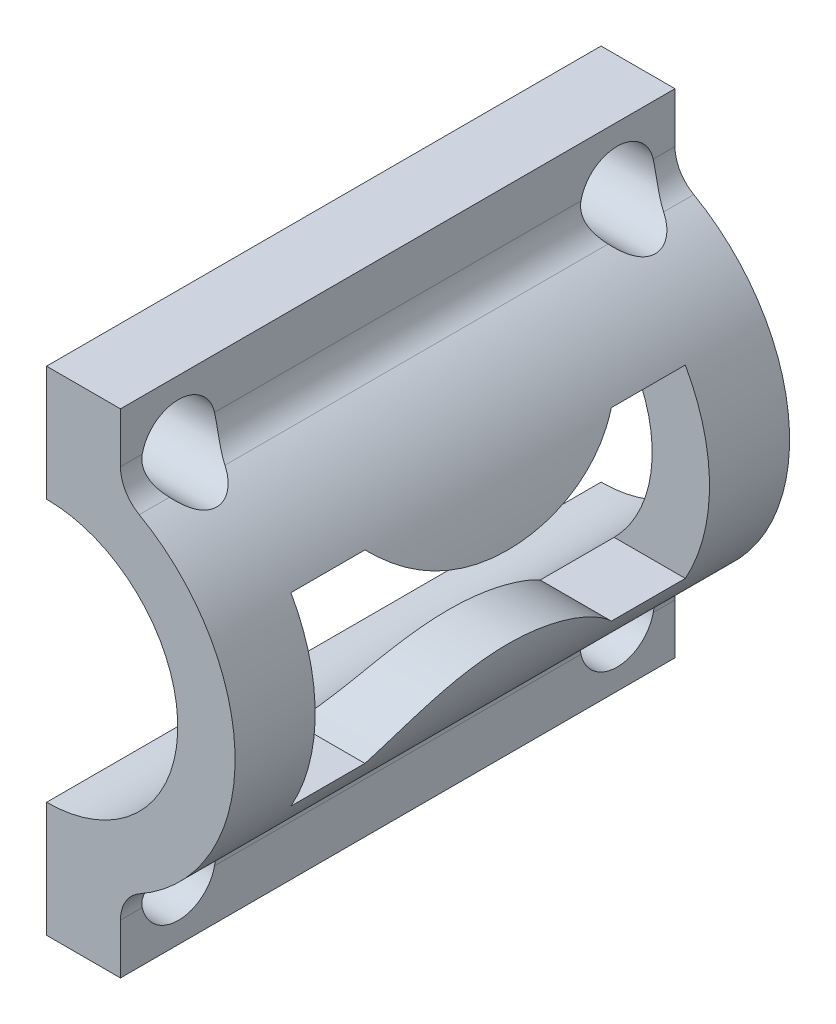
from build123d import *

# Parameters (mm, degrees)
BOSS_EXTRUDE2_DEPTH = 22.5
FILLET1_R           = 3
SKETCH2_R           = 3
CUT_EXTRUDE1_DEPTH  = 45
CUT_EXTRUDE2_DEPTH  = 34.768920734


with BuildPart() as part:
    # Sketch1 → Boss-Extrude2 (new, symmetric)
    with BuildSketch(Plane.XY):
        with BuildLine():
            Line((0, 10.65), (0, 20))
            Line((0, 20), (6, 20))
            Line((6, 20), (6, 14.074444927))
            ThreePointArc((6, 14.074444927), (15.3, 0), (6, -14.074444927))
            Line((6, -14.074444927), (6, -20))
            Line((6, -20), (0, -20))
            Line((0, -20), (0, -10.65))
            ThreePointArc((0, -10.65), (10.65, 0), (0, 10.65))
        make_face()
    extrude(amount=BOSS_EXTRUDE2_DEPTH, both=True)

    # Fillet1
    fillet1_edges = [part.edges().sort_by_distance(p)[0] for p in [
        (6, 14.074444927, 0),
        (6, -14.074444927, 0),
    ]]
    fillet(fillet1_edges, radius=FILLET1_R)

    # Sketch2 → Cut-Extrude1 (cut)
    with BuildSketch(Plane.ZY):
        with Locations((-17.8, 15.3)):
            Circle(SKETCH2_R)
        with Locations((17.8, 15.3)):
            Circle(SKETCH2_R)
        with Locations((17.8, -15.3)):
            Circle(SKETCH2_R)
        with Locations((-17.8, -15.3)):
            Circle(SKETCH2_R)
    extrude(amount=-CUT_EXTRUDE1_DEPTH, mode=Mode.SUBTRACT)

    # Sketch3 → Cut-Extrude2 (cut, through all)
    with BuildSketch(Plane.ZY):
        with BuildLine():
            Line((16, 7.5), (10, 7.5))
            ThreePointArc((10, 7.5), (0, 3.297958971), (-10, 7.5))
            Line((-10, 7.5), (-16, 7.5))
            Line((-16, 7.5), (-16, -7.5))
            Line((-16, -7.5), (-10, -7.5))
            ThreePointArc((-10, -7.5), (0, -3.297958971), (10, -7.5))
            Line((10, -7.5), (16, -7.5))
            Line((16, -7.5), (16, 7.5))
        make_face()
    extrude(amount=-CUT_EXTRUDE2_DEPTH, mode=Mode.SUBTRACT)


solid = part.part
